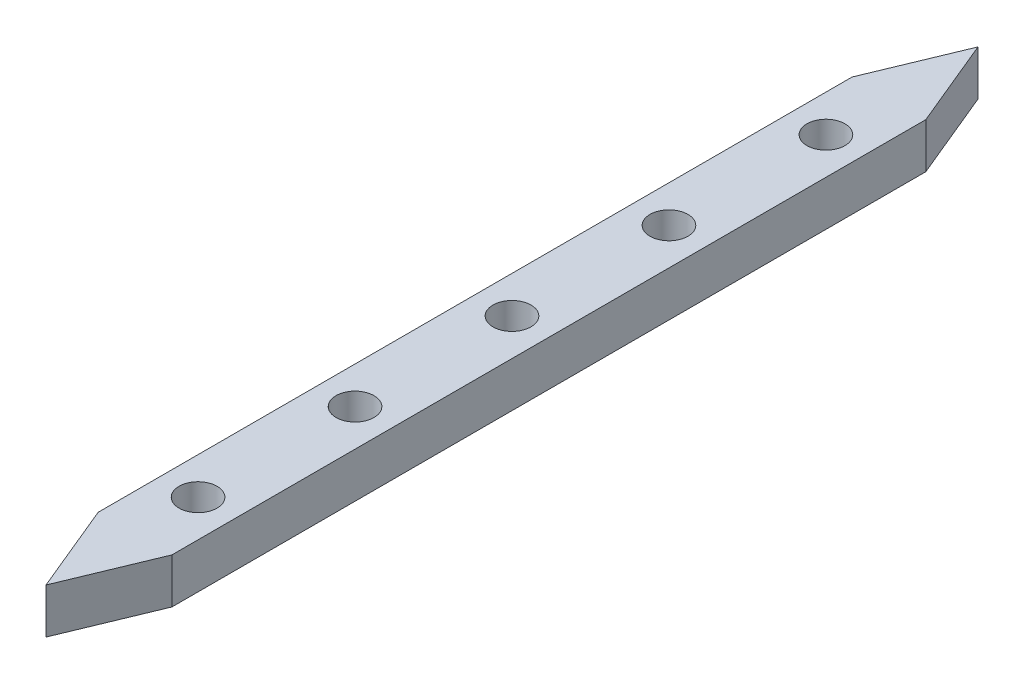
from build123d import *

# Parameters (mm, degrees)
BOSS_EXTRUDE1_DEPTH          = 5.842
F_10_0_1935_DIAMETER_HOLE1_D = 4.9149


with BuildPart() as part:
    # Sketch1 → Boss-Extrude1 (new body)
    with BuildSketch(Plane(origin=(0, 0, 0), x_dir=(1, 0, 0), z_dir=(0, 1, 0))):
        Polygon((0, 60.325), (-4.7752, 48.796647397), (-4.7752, -48.796647397), (0, -60.325), (4.7752, -48.796647397), (4.7752, 48.796647397), align=None)
    extrude(amount=BOSS_EXTRUDE1_DEPTH)

    # #10 (0.1935) Diameter Hole1 (through all)
    with Locations(Plane(origin=(0, 5.842, 0), x_dir=(1, 0, 0), z_dir=(0, 1, 0))):
        with Locations((0, 20.32), (0, 40.64), (0, 0), (0, -20.32), (0, -40.64)):
            Hole(F_10_0_1935_DIAMETER_HOLE1_D / 2)


solid = part.part
